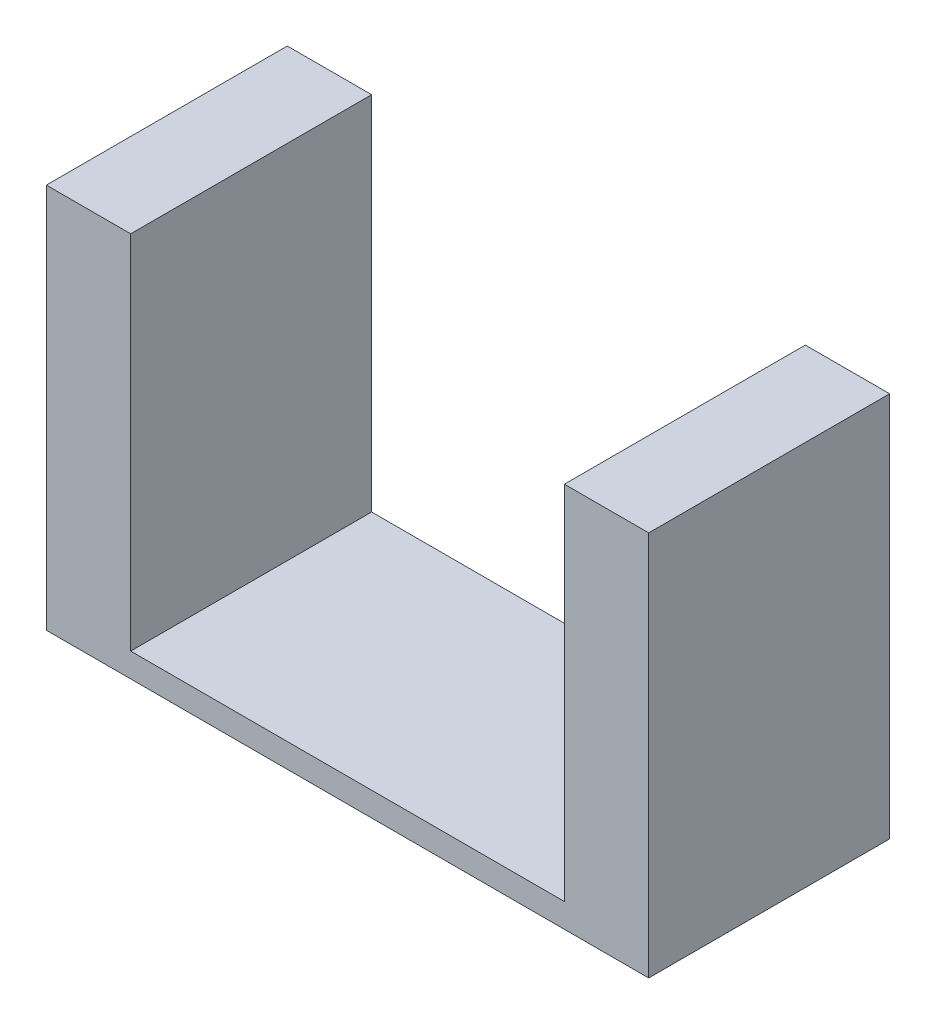
from build123d import *

# Parameters (mm, degrees)
SKETCH1_W           = 50
SKETCH1_H           = 20
BOSS_EXTRUDE1_DEPTH = 2
SKETCH2_W           = 7
SKETCH2_H           = 20
BOSS_EXTRUDE2_DEPTH = 30


with BuildPart() as part:
    # Sketch1 → Boss-Extrude1 (new body)
    with BuildSketch(Plane(origin=(0, 0, 0), x_dir=(1, 0, 0), z_dir=(0, 1, 0))):
        Rectangle(SKETCH1_W, SKETCH1_H)
    extrude(amount=BOSS_EXTRUDE1_DEPTH)

    # Sketch2 → Boss-Extrude2 (add)
    with BuildSketch(Plane(origin=(0, 2, 0), x_dir=(1, 0, 0), z_dir=(0, 1, 0))):
        with Locations((-21.5, 0)):
            Rectangle(SKETCH2_W, SKETCH2_H)
        with Locations((21.5, 0)):
            Rectangle(SKETCH2_W, SKETCH2_H)
    extrude(amount=BOSS_EXTRUDE2_DEPTH)


solid = part.part
